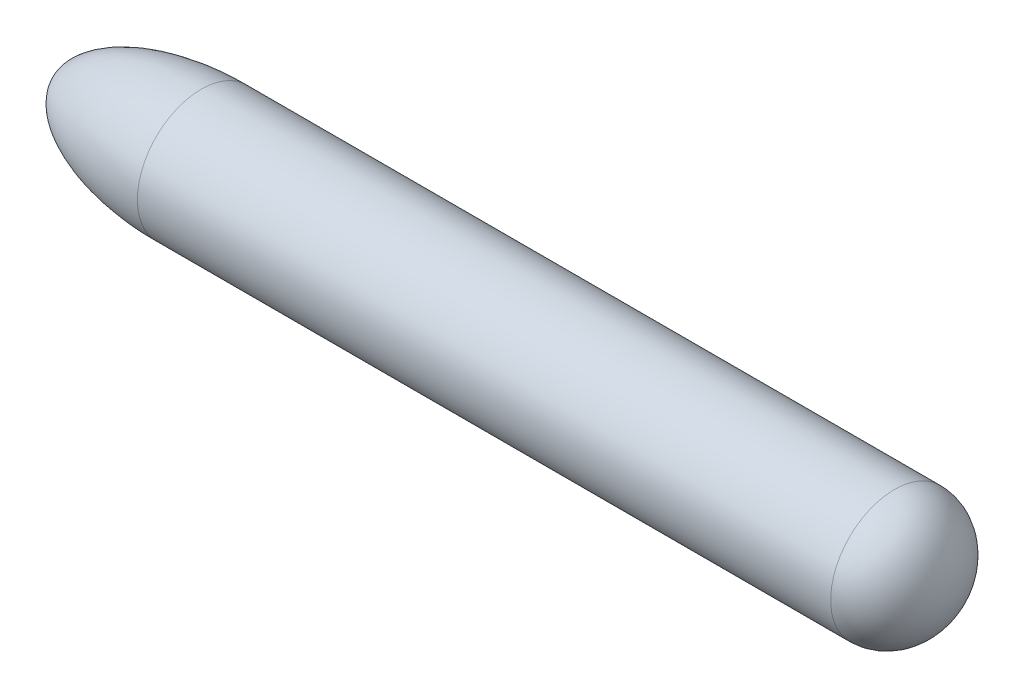
from build123d import *

# Parameters (mm, degrees)
SKETCH1_R           = 115
BOSS_EXTRUDE2_DEPTH = 761.29
BOSS_EXTRUDE3_START = -487.1
SKETCH2_R           = 115
BOSS_EXTRUDE3_DEPTH = 487.1


with BuildPart() as part:
    # Sketch1 → Boss-Extrude2 (new body)
    with BuildSketch(Plane(origin=(0, 0, 0), x_dir=(0, 0, -1), z_dir=(1, 0, 0))):
        Circle(SKETCH1_R)
    extrude(amount=BOSS_EXTRUDE2_DEPTH)

    # Sketch2 → Boss-Extrude3 (add)
    with BuildSketch(Plane(origin=(0, 0, 0), x_dir=(0, 0, -1), z_dir=(1, 0, 0)).offset(BOSS_EXTRUDE3_START)):
        Circle(SKETCH2_R)
    extrude(amount=BOSS_EXTRUDE3_DEPTH)

    # Sketch3 → Revolve1 (revolve)
    with BuildSketch(Plane(origin=(0, 0, 0), x_dir=(1, 0, 0), z_dir=(0, 1, 0))):
        with BuildLine():
            Line((761.29, 0), (858.06, 0))
            add(Edge.make_bspline(
                [(858.06, 0), (858.06, 115), (761.29, 115)],
                knots=[4.71238898, 4.71238898, 4.71238898, 6.283185307, 6.283185307, 6.283185307], degree=2, weights=[1, 0.707106781, 1]))
            Line((761.29, 115), (761.29, 0))
        make_face()
    revolve(axis=Axis((761.29, 0, 0), (1, 0, 0)))

    # Sketch4 → Revolve2 (revolve)
    with BuildSketch(Plane(origin=(0, 0, 0), x_dir=(1, 0, 0), z_dir=(0, 1, 0))):
        with BuildLine():
            Line((-487.1, 0), (-741.94, 0))
            add(Edge.make_bspline(
                [(-741.94, 0), (-741.94, -115), (-487.1, -115)],
                knots=[0, 0, 0, 1.570796327, 1.570796327, 1.570796327], degree=2, weights=[1, 0.707106781, 1]))
            Line((-487.1, -115), (-487.1, 0))
        make_face()
    revolve(axis=Axis((858.06, 0, 0), (-1, 0, 0)))


solid = part.part
